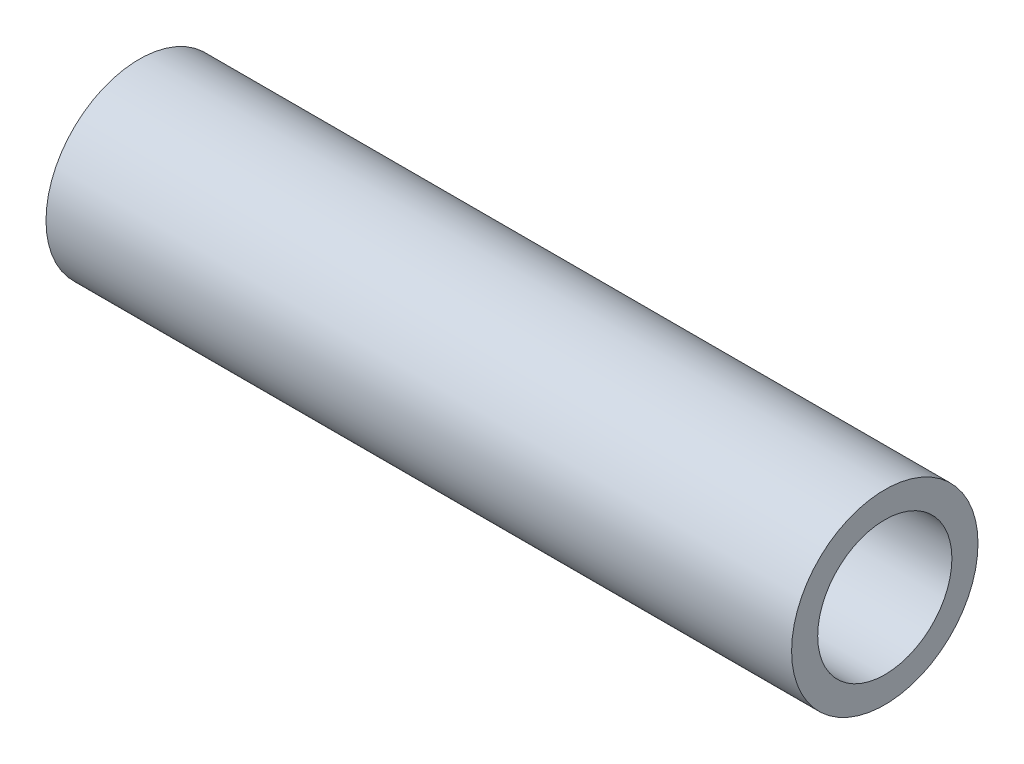
from build123d import *

# Parameters (mm, degrees)
SKETCH_4_R          = 2.5
EXTRUDE_1_DEPTH     = 20
SKETCH_5_R          = 1.8
CUT_EXTRUDE_2_DEPTH = 20


with BuildPart() as part:
    # 草图4 → 凸台-拉伸1 (new body)
    with BuildSketch(Plane(origin=(0, 0, 0), x_dir=(0, 0, -1), z_dir=(1, 0, 0))):
        Circle(SKETCH_4_R)
    extrude(amount=EXTRUDE_1_DEPTH)

    # 草图5 → 切除-拉伸2 (cut)
    with BuildSketch(Plane.ZY):
        Circle(SKETCH_5_R)
    extrude(amount=-CUT_EXTRUDE_2_DEPTH, mode=Mode.SUBTRACT)


solid = part.part
